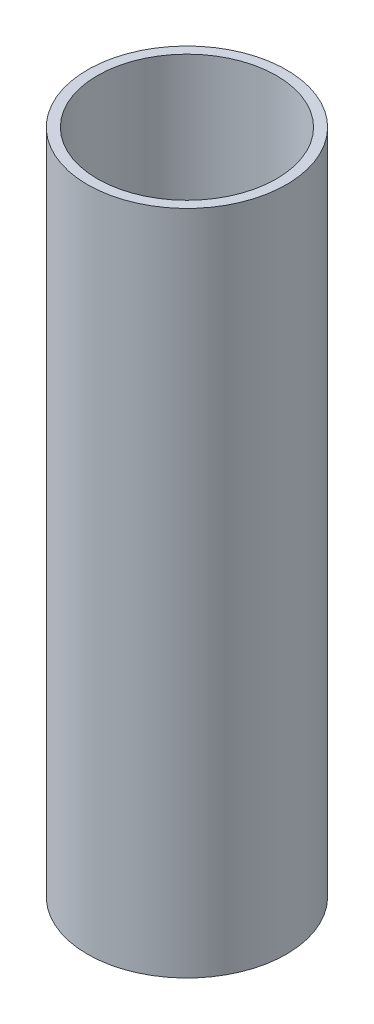
from build123d import *

# Parameters (mm, degrees)
SKETCH_1_R      = 10
SKETCH_1_R_2    = 9
EXTRUDE_1_DEPTH = 67


with BuildPart() as part:
    # 草图1 → 凸台-拉伸1 (new body)
    with BuildSketch(Plane(origin=(0, 0, 0), x_dir=(1, 0, 0), z_dir=(0, 1, 0))):
        with Locations(Location((0, 0, 0), (0, 0, 270))):
            Circle(SKETCH_1_R)
        with Locations(Location((0, 0, 0), (0, 0, 270))):
            Circle(SKETCH_1_R_2, mode=Mode.SUBTRACT)
    extrude(amount=EXTRUDE_1_DEPTH)


solid = part.part
